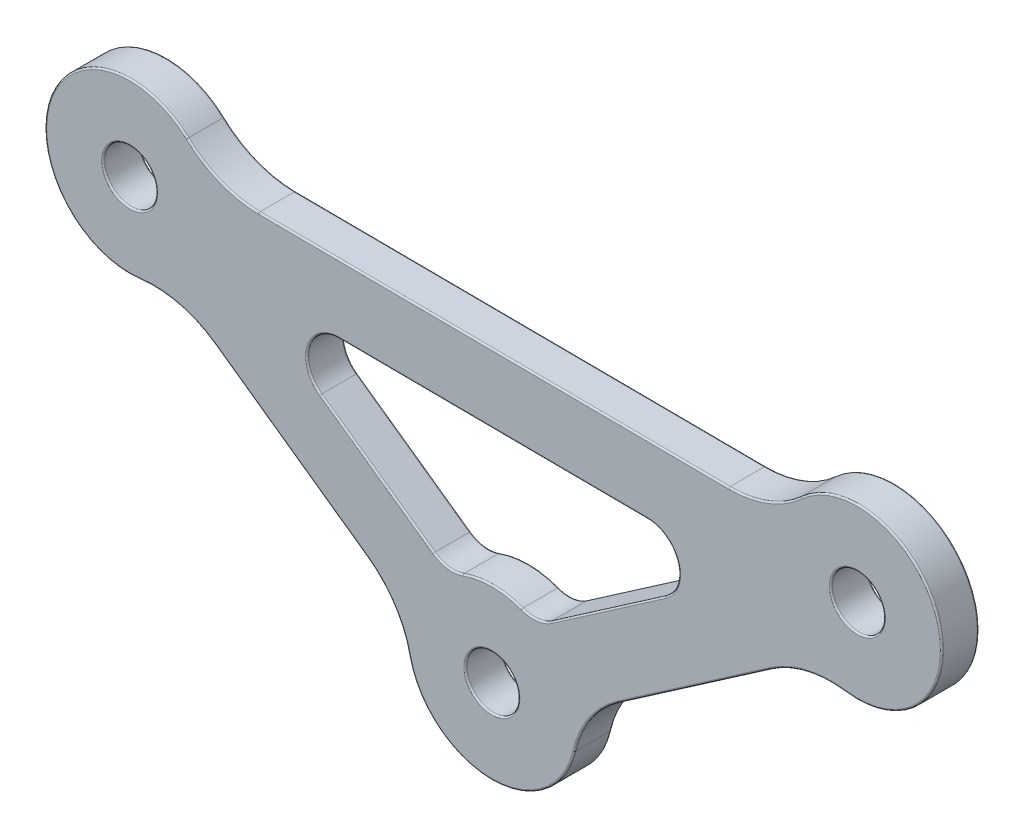
from build123d import *

# Parameters (mm, degrees)
SKETCH1_R             = 8
SKETCH1_R_2           = 2.5
BOSS_EXTRUDE1_DEPTH   = 3.5
BOSS_EXTRUDE1_2_DEPTH = 3.5
BOSS_EXTRUDE1_3_DEPTH = 3.5
EXTRUDE_THIN1_DEPTH   = 3.5
FILLET1_R             = 3
FILLET2_R             = 10
FILLET3_R             = 0.15


with BuildPart() as part:
    # Sketch1 → Boss-Extrude1 (new body)
    with BuildSketch(Plane.XY):
        with Locations((-100.394277379, 222.585897742)):
            Circle(SKETCH1_R)
        with Locations((-100.394277379, 222.585897742)):
            Circle(SKETCH1_R_2, mode=Mode.SUBTRACT)
    extrude(amount=-BOSS_EXTRUDE1_DEPTH)



with BuildPart() as body_2:
    # Sketch1 → Boss-Extrude1 2 (new body)
    with BuildSketch(Plane.XY):
        with Locations((-66.146241747, 198.273924243)):
            Circle(SKETCH1_R)
        with Locations((-66.146241747, 198.273924243)):
            Circle(SKETCH1_R_2, mode=Mode.SUBTRACT)
    extrude(amount=-BOSS_EXTRUDE1_2_DEPTH)


with BuildPart() as body_3:
    # Sketch1 → Boss-Extrude1 3 (new body)
    with BuildSketch(Plane.XY):
        with Locations((-31.586941599, 222.141365942)):
            Circle(SKETCH1_R)
        with Locations((-31.586941599, 222.141365942)):
            Circle(SKETCH1_R_2, mode=Mode.SUBTRACT)
    extrude(amount=-BOSS_EXTRUDE1_3_DEPTH)


with BuildPart() as part_1:
    add(part.part)

    add(body_2.part)  # Extrude-Thin1 merges body 2

    add(body_3.part)  # Extrude-Thin1 merges body 3
    # Sketch2 → Extrude-Thin1 (add)
    with BuildSketch(Plane.XY):
        Polygon((-93.51160577, 219.291364217), (-38.51160577, 218.936035113), (-38.469613207, 225.435899467), (-93.469613207, 225.791228571), align=None)
        Polygon((-97.382984524, 216.462613056), (-72.92010193, 199.0969177), (-69.157534602, 204.397208929), (-93.620417196, 221.762904285), align=None)
        Polygon((-38.370869847, 221.405962973), (-63.056084238, 204.357790331), (-59.362313499, 199.009327213), (-34.677099108, 216.057499855), align=None)
    extrude(amount=-EXTRUDE_THIN1_DEPTH)

    # Fillet1
    fillet1_edges = [part_1.edges().sort_by_distance(p)[0] for p in [
        (-41.915405882, 218.958025463, -1.75),
        (-90.107805659, 219.269373867, -1.75),
        (-70.225825227, 205.15556639, -1.75),
        (-61.978084416, 205.10228162, -1.75),
    ]]
    fillet(fillet1_edges, radius=FILLET1_R)

    # Fillet2
    fillet2_edges = [part_1.edges().sort_by_distance(p)[0] for p in [
        (-93.06333789, 225.788603818, -1.75),
        (-38.875888525, 225.438524221, -1.75),
        (-96.314693899, 215.704255595, -1.75),
        (-73.988392554, 199.855275161, -1.75),
        (-58.284313677, 199.753818502, -1.75),
        (-35.75509893, 215.313008566, -1.75),
    ]]
    fillet(fillet2_edges, radius=FILLET2_R)

    # Fillet3
    fillet3_edges = [part_1.edges().sort_by_distance(p)[0] for p in [
        (-66.01160577, 219.113699665, 0),
        (-66.01160577, 219.113699665, -3.5),
        (-76.997670746, 209.96275973, 0),
        (-76.997670746, 209.96275973, -3.5),
        (-55.144692732, 209.821577928, 0),
        (-55.144692732, 209.821577928, -3.5),
        (-66.094558593, 206.273757295, -3.5),
        (-66.094558593, 206.273757295, 0),
        (-83.467864105, 217.128549949, -3.5),
        (-83.467864105, 217.128549949, 0),
        (-48.582453734, 216.903171737, -3.5),
        (-48.582453734, 216.903171737, 0),
        (-70.310622021, 205.6370525, -3.5),
        (-70.310622021, 205.6370525, 0),
        (-61.88707365, 205.58263192, 0),
        (-61.88707365, 205.58263192, -3.5),
        (-66.197924902, 190.274091192, -3.5),
        (-66.197924902, 190.274091192, 0),
        (-85.151543227, 207.779765378, 0),
        (-85.151543227, 207.779765378, -3.5),
        (-47.019706303, 207.533413534, 0),
        (-47.019706303, 207.533413534, -3.5),
        (-65.969613207, 225.613564019, 0),
        (-65.969613207, 225.613564019, -3.5),
        (-23.94182379, 224.497671035, 0),
        (-23.94182379, 224.497671035, -3.5),
        (-108.008312339, 225.040785036, 0),
        (-108.008312339, 225.040785036, -3.5),
        (-75.39571328, 200.016646176, -3.5),
        (-75.39571328, 200.016646176, 0),
        (-56.875025427, 199.896992732, 0),
        (-56.875025427, 199.896992732, -3.5),
        (-40.11243124, 226.129577289, -3.5),
        (-40.11243124, 226.129577289, 0),
        (-36.388070118, 214.045751802, -3.5),
        (-36.388070118, 214.045751802, 0),
        (-95.698149162, 214.428926297, -3.5),
        (-95.698149162, 214.428926297, 0),
        (-91.817969628, 226.463622428, -3.5),
        (-91.817969628, 226.463622428, 0),
        (-34.086941599, 222.141365942, -3.5),
        (-34.086941599, 222.141365942, 0),
        (-102.894277379, 222.585897742, -3.5),
        (-102.894277379, 222.585897742, 0),
        (-68.646241747, 198.273924243, -3.5),
        (-68.646241747, 198.273924243, 0),
    ]]
    fillet(fillet3_edges, radius=FILLET3_R)


solid = part_1.part
